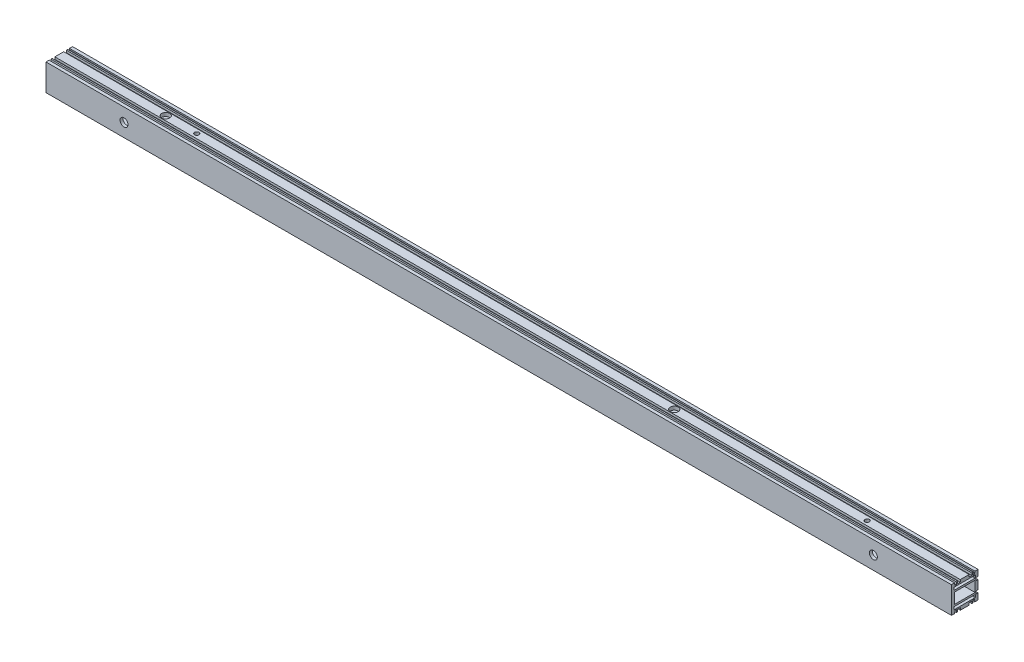
from build123d import *

# Parameters (mm, degrees)
SKETCH_1_W                = 23.5
SKETCH_1_H                = 12
EXTRUDE_1_DEPTH           = 510.5
HOLE_WIZARD_M6_1_D        = 5
HOLE_WIZARD_M6_1_DEPTH    = 19
HOLE_WIZARD_M6_1_TIP      = 1.502151548
HOLE_WIZARD_M6_2_D        = 5
HOLE_WIZARD_M6_2_DEPTH    = 15
HOLE_WIZARD_M6_2_TIP      = 1.502151548
HOLE_WIZARD_9_0_9_1_D     = 9
HOLE_WIZARD_M6_3_D        = 5
HOLE_WIZARD_M6_3_DEPTH    = 15
HOLE_WIZARD_M6_3_TIP      = 1.502151548
HOLE_WIZARD_9_0_9_2_D     = 9
HOLE_WIZARD_7_0_7_1_D     = 7
HOLE_WIZARD_7_0_7_1_DEPTH = 15
HOLE_WIZARD_7_0_7_1_TIP   = 2.103012167
HOLE_WIZARD_M6_4_D        = 5
HOLE_WIZARD_M6_4_DEPTH    = 17
HOLE_WIZARD_M6_4_TIP      = 1.502151548


with BuildPart() as part:
    # 草图1 → 凸台-拉伸1 (new, symmetric)
    with BuildSketch(Plane(origin=(0, 0, 0), x_dir=(0, 0, -1), z_dir=(1, 0, 0))):
        Polygon((-15, 15), (-11.5, 15), (-11.5, 13.5), (-11, 13.5), (-11, 12), (-9.5, 12), (-9.5, 15), (-8, 15), (-8, 12.5), (-5, 12.5), (-5, 15), (5, 15), (5, 12.5), (8, 12.5), (8, 15), (9.5, 15), (9.5, 12), (11, 12), (11, 13.5), (11.5, 13.5), (11.5, 15), (15, 15), (15, 8), (12.5, 8), (12.5, 5), (15, 5), (15, -5), (12.5, -5), (12.5, -8), (15, -8), (15, -15), (11.5, -15), (11.5, -13.5), (11, -13.5), (11, -12), (9.5, -12), (9.5, -15), (8, -15), (8, -12.5), (5, -12.5), (5, -15), (-5, -15), (-5, -12.5), (-8, -12.5), (-8, -15), (-9.5, -15), (-9.5, -12), (-11, -12), (-11, -13.5), (-11.5, -13.5), (-11.5, -15), (-15, -15), align=None)
        with BuildLine():
            Line((12, -10.5), (12, -8.5))
            ThreePointArc((12, -8.5), (11.853553391, -8.146446609), (11.5, -8))
            Line((11.5, -8), (-11.5, -8))
            ThreePointArc((-11.5, -8), (-11.853553391, -8.146446609), (-12, -8.5))
            Line((-12, -8.5), (-12, -10.5))
            ThreePointArc((-12, -10.5), (-11.853553391, -10.853553391), (-11.5, -11))
            Line((-11.5, -11), (11.5, -11))
            ThreePointArc((11.5, -11), (11.853553391, -10.853553391), (12, -10.5))
        make_face(mode=Mode.SUBTRACT)
        with BuildLine():
            Line((-11.5, 11), (11.5, 11))
            ThreePointArc((11.5, 11), (11.853553391, 10.853553391), (12, 10.5))
            Line((12, 10.5), (12, 8.5))
            ThreePointArc((12, 8.5), (11.853553391, 8.146446609), (11.5, 8))
            Line((11.5, 8), (-11.5, 8))
            ThreePointArc((-11.5, 8), (-11.853553391, 8.146446609), (-12, 8.5))
            Line((-12, 8.5), (-12, 10.5))
            ThreePointArc((-12, 10.5), (-11.853553391, 10.853553391), (-11.5, 11))
        make_face(mode=Mode.SUBTRACT)
        Rectangle(SKETCH_1_W, SKETCH_1_H, mode=Mode.SUBTRACT)
    extrude(amount=EXTRUDE_1_DEPTH, both=True)

    # M6 螺纹孔1
    with Locations(Plane(origin=(0, 0, -15), x_dir=(-1, 0, 0), z_dir=(0, 0, -1))):
        with Locations((460.5, 0), (445.5, 0), (-445.5, 0), (-460.5, 0)):
            Hole(HOLE_WIZARD_M6_1_D / 2, depth=HOLE_WIZARD_M6_1_DEPTH)
            with Locations((0, 0, -(HOLE_WIZARD_M6_1_DEPTH + HOLE_WIZARD_M6_1_TIP / 2))):  # 118° drill point
                Cone(0, HOLE_WIZARD_M6_1_D / 2, HOLE_WIZARD_M6_1_TIP, mode=Mode.SUBTRACT)

    # M6 螺纹孔2
    with Locations(Plane(origin=(0, -15, 0), x_dir=(-1, 0, 0), z_dir=(0, -1, 0))):
        with Locations((-460.5, 0), (-445.5, 0), (215.5, 0), (230.5, 0), (445.5, 0), (460.5, 0)):
            Hole(HOLE_WIZARD_M6_2_D / 2, depth=HOLE_WIZARD_M6_2_DEPTH)
            with Locations((0, 0, -(HOLE_WIZARD_M6_2_DEPTH + HOLE_WIZARD_M6_2_TIP / 2))):  # 118° drill point
                Cone(0, HOLE_WIZARD_M6_2_D / 2, HOLE_WIZARD_M6_2_TIP, mode=Mode.SUBTRACT)

    # Ø9.0 (9) 直径孔1 (through all)
    with Locations(Plane.XY.offset(15)):
        with Locations((-422.5, 0), (422.5, 0)):
            Hole(HOLE_WIZARD_9_0_9_1_D / 2)

    # M6 螺纹孔3
    with Locations(Plane(origin=(0, 15, 0), x_dir=(1, 0, 0), z_dir=(0, 1, 0))):
        with Locations((-355.5, 0), (400.5, 0)):
            Hole(HOLE_WIZARD_M6_3_D / 2, depth=HOLE_WIZARD_M6_3_DEPTH)
            with Locations((0, 0, -(HOLE_WIZARD_M6_3_DEPTH + HOLE_WIZARD_M6_3_TIP / 2))):  # 118° drill point
                Cone(0, HOLE_WIZARD_M6_3_D / 2, HOLE_WIZARD_M6_3_TIP, mode=Mode.SUBTRACT)

    # Ø9.0 (9) 直径孔2 (through all)
    with Locations(Plane(origin=(0, -15, 0), x_dir=(-1, 0, 0), z_dir=(0, -1, 0))):
        with Locations((-183, 0), (390.5, 0)):
            Hole(HOLE_WIZARD_9_0_9_2_D / 2)

    # Ø7.0 (7) 直径孔1
    with Locations(Plane(origin=(0, -15, 0), x_dir=(-1, 0, 0), z_dir=(0, -1, 0))):
        with Locations((-400.5, 0), (355.5, 0)):
            Hole(HOLE_WIZARD_7_0_7_1_D / 2, depth=HOLE_WIZARD_7_0_7_1_DEPTH)
            with Locations((0, 0, -(HOLE_WIZARD_7_0_7_1_DEPTH + HOLE_WIZARD_7_0_7_1_TIP / 2))):  # 118° drill point
                Cone(0, HOLE_WIZARD_7_0_7_1_D / 2, HOLE_WIZARD_7_0_7_1_TIP, mode=Mode.SUBTRACT)

    # M6 螺纹孔4
    with Locations(Plane(origin=(0, 0, -15), x_dir=(-1, 0, 0), z_dir=(0, 0, -1))):
        with Locations((-368.5, 0), (-298.499999898, 0)):
            Hole(HOLE_WIZARD_M6_4_D / 2, depth=HOLE_WIZARD_M6_4_DEPTH)
            with Locations((0, 0, -(HOLE_WIZARD_M6_4_DEPTH + HOLE_WIZARD_M6_4_TIP / 2))):  # 118° drill point
                Cone(0, HOLE_WIZARD_M6_4_D / 2, HOLE_WIZARD_M6_4_TIP, mode=Mode.SUBTRACT)


solid = part.part
